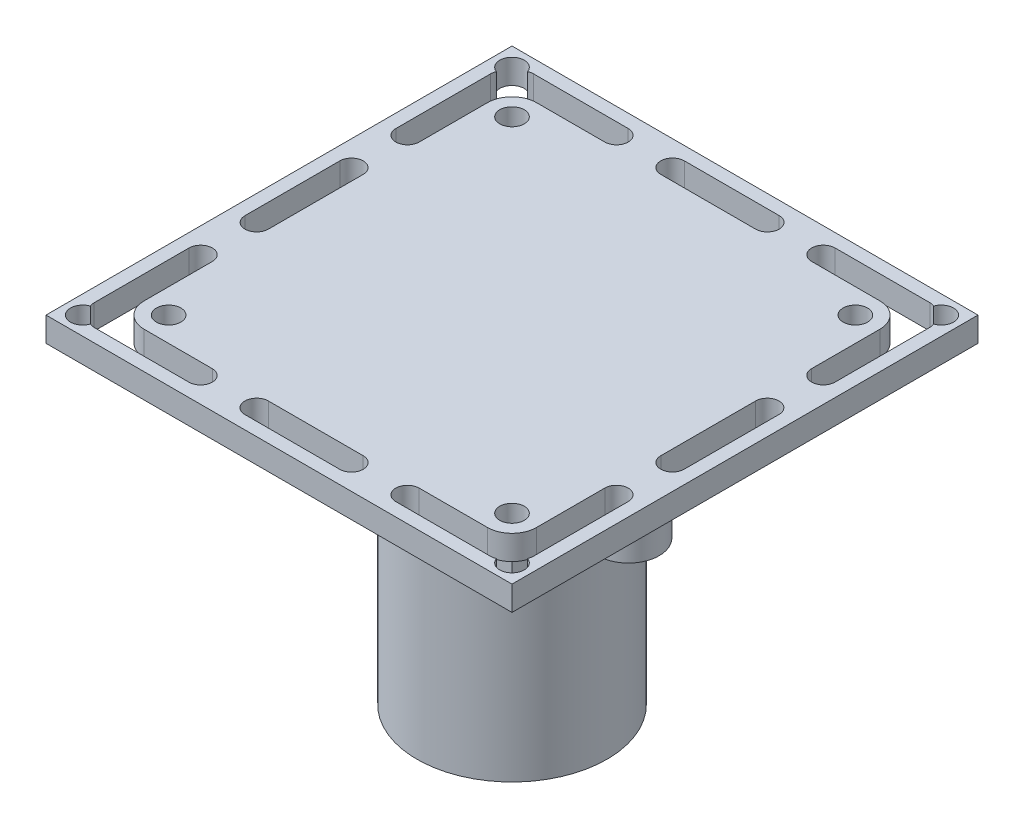
from build123d import *

# Parameters (mm, degrees)
SKETCH_1_W          = 38
SKETCH_1_H          = 38
SKETCH_1_R          = 1
EXTRUDE_1_DEPTH     = 2
CUT_EXTRUDE_1_DEPTH = 27.944387171
EXTRUDE_2_DEPTH     = 9
SKETCH_4_R          = 7.75
EXTRUDE_3_DEPTH     = 16.5


with BuildPart() as part:
    # 草图1 → 凸台-拉伸1 (new body)
    with BuildSketch(Plane(origin=(0, 0, 0), x_dir=(1, 0, 0), z_dir=(0, 1, 0))):
        Rectangle(SKETCH_1_W, SKETCH_1_H)
        with BuildLine():
            ThreePointArc((-8.433484656, 17.913076839), (-7.476946236, 16.95653842), (-8.433484656, 16))
            Line((-8.433484656, 16), (-14, 16))
            ThreePointArc((-14, 16), (-15.414213562, 15.414213562), (-16, 14))
            Line((-16, 14), (-16, 8.433484656))
            ThreePointArc((-16, 8.433484656), (-16.954069804, 7.479414851), (-17.908139609, 8.433484656))
            Line((-17.908139609, 8.433484656), (-17.908139609, 16.166515344))
            ThreePointArc((-17.908139609, 16.166515344), (-17.887296699, 16.3648503), (-17.825678652, 16.554519479))
            ThreePointArc((-17.825678652, 16.554519479), (-18.208704938, 18.205505004), (-16.55600298, 17.829953976))
            ThreePointArc((-16.55600298, 17.829953976), (-16.365644717, 17.892064742), (-16.166515344, 17.913076839))
            Line((-16.166515344, 17.913076839), (-8.433484656, 17.913076839))
        make_face(mode=Mode.SUBTRACT)
        with BuildLine():
            ThreePointArc((-17.908139609, 3.866515344), (-16.954069804, 4.820585149), (-16, 3.866515344))
            Line((-16, 3.866515344), (-16, -3.866515344))
            ThreePointArc((-16, -3.866515344), (-16.954069804, -4.820585149), (-17.908139609, -3.866515344))
            Line((-17.908139609, -3.866515344), (-17.908139609, 3.866515344))
        make_face(mode=Mode.SUBTRACT)
        with BuildLine():
            ThreePointArc((-3.866515344, -17.91801407), (-4.825522379, -16.959007035), (-3.866515344, -16))
            Line((-3.866515344, -16), (3.866515344, -16))
            ThreePointArc((3.866515344, -16), (4.825522379, -16.959007035), (3.866515344, -17.91801407))
            Line((3.866515344, -17.91801407), (-3.866515344, -17.91801407))
        make_face(mode=Mode.SUBTRACT)
        with BuildLine():
            ThreePointArc((17.908139609, -3.866515344), (16.954069804, -4.820585149), (16, -3.866515344))
            Line((16, -3.866515344), (16, 3.866515344))
            ThreePointArc((16, 3.866515344), (16.954069804, 4.820585149), (17.908139609, 3.866515344))
            Line((17.908139609, 3.866515344), (17.908139609, -3.866515344))
        make_face(mode=Mode.SUBTRACT)
        with BuildLine():
            ThreePointArc((3.866515344, 17.91801407), (4.825522379, 16.959007035), (3.866515344, 16))
            Line((3.866515344, 16), (-3.866515344, 16))
            ThreePointArc((-3.866515344, 16), (-4.825522379, 16.959007035), (-3.866515344, 17.91801407))
            Line((-3.866515344, 17.91801407), (3.866515344, 17.91801407))
        make_face(mode=Mode.SUBTRACT)
        with Locations(Location((-14, -14, 0), (0, 0, 270))):
            Circle(SKETCH_1_R, mode=Mode.SUBTRACT)
        with Locations(Location((14, -14, 0), (0, 0, 270))):
            Circle(SKETCH_1_R, mode=Mode.SUBTRACT)
        with Locations(Location((-14, 14, 0), (0, 0, 270))):
            Circle(SKETCH_1_R, mode=Mode.SUBTRACT)
        with Locations(Location((14, 14, 0), (0, 0, 270))):
            Circle(SKETCH_1_R, mode=Mode.SUBTRACT)
    extrude(amount=EXTRUDE_1_DEPTH)

    # 草图2 → 切除-拉伸1 (cut, through all)
    with BuildSketch(Plane(origin=(0, 2, 0), x_dir=(1, 0, 0), z_dir=(0, 1, 0))):
        with BuildLine():
            Line((-17.908139609, -16.166515344), (-17.908139609, -8.433484656))
            ThreePointArc((-17.908139609, -8.433484656), (-16.954069804, -7.479414851), (-16, -8.433484656))
            Line((-16, -8.433484656), (-16, -14))
            ThreePointArc((-16, -14), (-15.414213562, -15.414213562), (-14, -16))
            Line((-14, -16), (-8.433484656, -16.00493723))
            ThreePointArc((-8.433484656, -16.00493723), (-7.48026069, -16.959007035), (-8.433484656, -17.913076839))
            Line((-8.433484656, -17.913076839), (-16.166515344, -17.913076839))
            ThreePointArc((-16.166515344, -17.913076839), (-16.365644717, -17.892064742), (-16.55600298, -17.829953976))
            ThreePointArc((-16.55600298, -17.829953976), (-18.208704938, -18.205505004), (-17.825678652, -16.554519479))
            ThreePointArc((-17.825678652, -16.554519479), (-17.887296699, -16.3648503), (-17.908139609, -16.166515344))
        make_face()
        with BuildLine():
            Line((17.908139609, -16.166515344), (17.908139609, -8.433484656))
            ThreePointArc((17.908139609, -8.433484656), (16.954069804, -7.479414851), (16, -8.433484656))
            Line((16, -8.433484656), (16, -14))
            ThreePointArc((16, -14), (15.414213562, -15.414213562), (14, -16))
            Line((14, -16), (8.433484656, -16.00493723))
            ThreePointArc((8.433484656, -16.00493723), (7.48026069, -16.959007035), (8.433484656, -17.913076839))
            Line((8.433484656, -17.913076839), (16.166515344, -17.913076839))
            ThreePointArc((16.166515344, -17.913076839), (16.365644717, -17.892064742), (16.55600298, -17.829953976))
            ThreePointArc((16.55600298, -17.829953976), (18.208704938, -18.205505004), (17.825678652, -16.554519479))
            ThreePointArc((17.825678652, -16.554519479), (17.887296699, -16.3648503), (17.908139609, -16.166515344))
        make_face()
        with BuildLine():
            Line((8.433484656, 17.913076839), (16.166515344, 17.913076839))
            ThreePointArc((16.166515344, 17.913076839), (16.365644717, 17.892064742), (16.55600298, 17.829953976))
            ThreePointArc((16.55600298, 17.829953976), (18.208704938, 18.205505004), (17.825678652, 16.554519479))
            ThreePointArc((17.825678652, 16.554519479), (17.887296699, 16.3648503), (17.908139609, 16.166515344))
            Line((17.908139609, 16.166515344), (17.908139609, 8.433484656))
            ThreePointArc((17.908139609, 8.433484656), (16.954069804, 7.479414851), (16, 8.433484656))
            Line((16, 8.433484656), (16, 14))
            ThreePointArc((16, 14), (15.414213562, 15.414213562), (14, 16))
            Line((14, 16), (8.433484656, 16.00493723))
            ThreePointArc((8.433484656, 16.00493723), (7.48026069, 16.959007035), (8.433484656, 17.913076839))
        make_face()
        with BuildLine():
            Line((-8.433484656, 17.913076839), (-16.166515344, 17.913076839))
            ThreePointArc((-16.166515344, 17.913076839), (-16.365644717, 17.892064742), (-16.55600298, 17.829953976))
            ThreePointArc((-16.55600298, 17.829953976), (-18.208704938, 18.205505004), (-17.825678652, 16.554519479))
            ThreePointArc((-17.825678652, 16.554519479), (-17.887296699, 16.3648503), (-17.908139609, 16.166515344))
            Line((-17.908139609, 16.166515344), (-17.908139609, 8.433484656))
            ThreePointArc((-17.908139609, 8.433484656), (-16.954069804, 7.479414851), (-16, 8.433484656))
            Line((-16, 8.433484656), (-16, 14))
            ThreePointArc((-16, 14), (-15.414213562, 15.414213562), (-14, 16))
            Line((-14, 16), (-8.433484656, 16.00493723))
            ThreePointArc((-8.433484656, 16.00493723), (-7.48026069, 16.959007035), (-8.433484656, 17.913076839))
        make_face()
    extrude(amount=-CUT_EXTRUDE_1_DEPTH, mode=Mode.SUBTRACT)

    # 草图3 → 凸台-拉伸2 (add)
    with BuildSketch(Plane.XZ):
        with BuildLine():
            Line((-8.5, 2.5), (-9.5, 2.5))
            ThreePointArc((-9.5, 2.5), (-12, 0), (-9.5, -2.5))
            Line((-9.5, -2.5), (-8.5, -2.5))
            Line((-8.5, -2.5), (-8.5, -8.5))
            Line((-8.5, -8.5), (8.5, -8.5))
            Line((8.5, -8.5), (8.5, -2.5))
            Line((8.5, -2.5), (9.5, -2.5))
            ThreePointArc((9.5, -2.5), (12, 0), (9.5, 2.5))
            Line((9.5, 2.5), (8.5, 2.5))
            Line((8.5, 2.5), (8.5, 8.5))
            Line((8.5, 8.5), (-8.5, 8.5))
            Line((-8.5, 8.5), (-8.5, 2.5))
        make_face()
    extrude(amount=EXTRUDE_2_DEPTH)

    # 草图4 → 凸台-拉伸3 (add)
    with BuildSketch(Plane.XZ.offset(9)):
        with Locations(Location((0, 0, 0), (0, 0, 270))):
            Circle(SKETCH_4_R)
    extrude(amount=EXTRUDE_3_DEPTH)


solid = part.part
